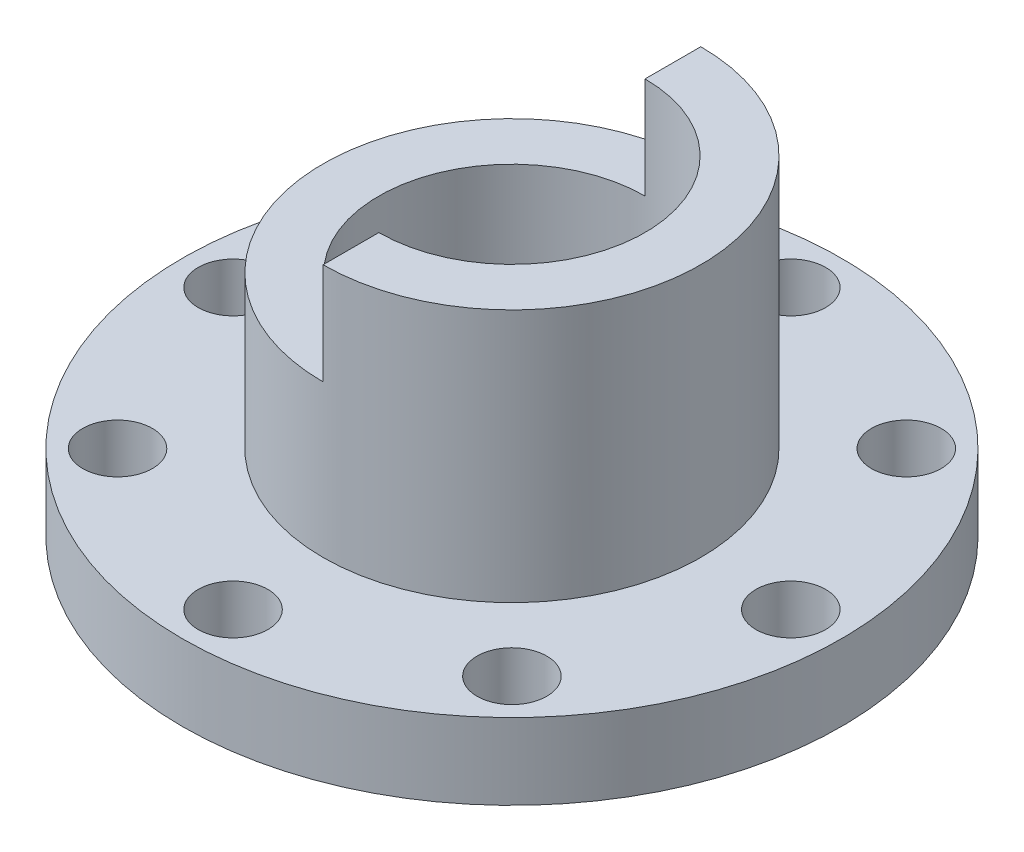
from build123d import *

# Parameters (mm, degrees)
SKETCH1_R           = 13
SKETCH1_R_2         = 1.375
SKETCH1_R_3         = 5
BOSS_EXTRUDE1_DEPTH = 3
SKETCH2_R           = 7.5
SKETCH2_R_2         = 5
BOSS_EXTRUDE2_DEPTH = 10
SKETCH3_R           = 5.25
CUT_EXTRUDE1_DEPTH  = 18
CUT_EXTRUDE2_DEPTH  = 4
CUT_EXTRUDE3_START  = -10
SKETCH5_R           = 7.5
SKETCH5_R_2         = 7.45
CUT_EXTRUDE3_DEPTH  = 10


with BuildPart() as part:
    # Sketch1 → Boss-Extrude1 (new body)
    with BuildSketch(Plane(origin=(0, 0, 0), x_dir=(1, 0, 0), z_dir=(0, 1, 0))):
        with Locations(Location((0, 0, 0), (0, 0, 270))):
            Circle(SKETCH1_R)
        with Locations(Location((0, 11, 0), (0, 0, 270))):
            Circle(SKETCH1_R_2, mode=Mode.SUBTRACT)
        with Locations(Location((7.778174593, 7.778174593, 0), (0, 0, 270))):
            Circle(SKETCH1_R_2, mode=Mode.SUBTRACT)
        with Locations(Location((11, 0, 0), (0, 0, 270))):
            Circle(SKETCH1_R_2, mode=Mode.SUBTRACT)
        with Locations(Location((7.778174593, -7.778174593, 0), (0, 0, 270))):
            Circle(SKETCH1_R_2, mode=Mode.SUBTRACT)
        with Locations(Location((0, -11, 0), (0, 0, 270))):
            Circle(SKETCH1_R_2, mode=Mode.SUBTRACT)
        with Locations(Location((-7.778174593, -7.778174593, 0), (0, 0, 270))):
            Circle(SKETCH1_R_2, mode=Mode.SUBTRACT)
        with Locations(Location((-11, 0, 0), (0, 0, 270))):
            Circle(SKETCH1_R_2, mode=Mode.SUBTRACT)
        with Locations(Location((-7.778174593, 7.778174593, 0), (0, 0, 270))):
            Circle(SKETCH1_R_2, mode=Mode.SUBTRACT)
        with Locations(Location((0, 0, 0), (0, 0, 270))):
            Circle(SKETCH1_R_3, mode=Mode.SUBTRACT)
    extrude(amount=BOSS_EXTRUDE1_DEPTH)

    # Sketch2 → Boss-Extrude2 (add)
    with BuildSketch(Plane(origin=(0, 3, 0), x_dir=(1, 0, 0), z_dir=(0, 1, 0))):
        with Locations(Location((0, 0, 0), (0, 0, 270))):
            Circle(SKETCH2_R)
        with Locations(Location((0, 0, 0), (0, 0, 270))):
            Circle(SKETCH2_R_2, mode=Mode.SUBTRACT)
    extrude(amount=BOSS_EXTRUDE2_DEPTH)

    # Sketch3 → Cut-Extrude1 (cut)
    with BuildSketch(Plane(origin=(0, 13, 0), x_dir=(1, 0, 0), z_dir=(0, 1, 0))):
        with Locations(Location((0, 0, 0), (0, 0, 270))):
            Circle(SKETCH3_R)
    extrude(amount=-CUT_EXTRUDE1_DEPTH, mode=Mode.SUBTRACT)

    # Sketch4 → Cut-Extrude2 (cut)
    with BuildSketch(Plane(origin=(0, 13, 0), x_dir=(1, 0, 0), z_dir=(0, 1, 0))):
        with BuildLine():
            Line((0, 5.25), (0, 7.5))
            ThreePointArc((0, 7.5), (-7.5, 0), (0, -7.5))
            Line((0, -7.5), (0, -5.25))
            ThreePointArc((0, -5.25), (-5.25, 0), (0, 5.25))
        make_face()
    extrude(amount=-CUT_EXTRUDE2_DEPTH, mode=Mode.SUBTRACT)

    # Sketch5 → Cut-Extrude3 (cut)
    with BuildSketch(Plane(origin=(0, 13, 0), x_dir=(1, 0, 0), z_dir=(0, 1, 0)).offset(CUT_EXTRUDE3_START)):
        Circle(SKETCH5_R)
        with Locations(Location((0, 0, 0), (0, 0, 270))):
            Circle(SKETCH5_R_2, mode=Mode.SUBTRACT)
    extrude(amount=CUT_EXTRUDE3_DEPTH, mode=Mode.SUBTRACT)


solid = part.part
